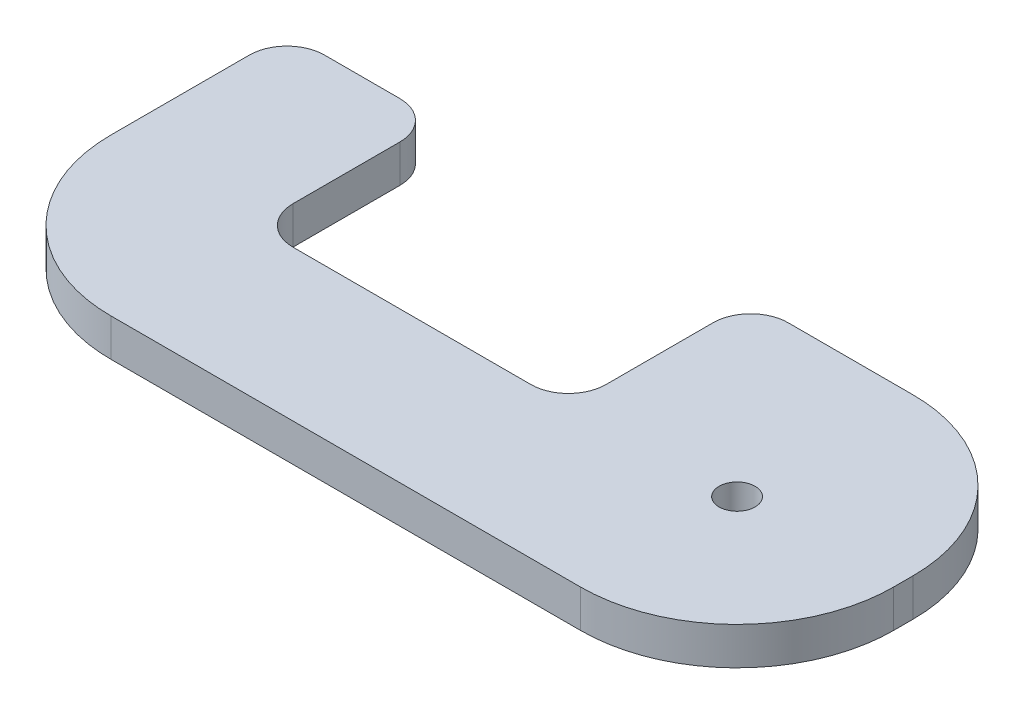
from build123d import *

# Parameters (mm, degrees)
SKETCH1_W           = 50.8
SKETCH1_H           = 21.59
BOSS_EXTRUDE1_DEPTH = 3.175
FILLET1_R           = 10.16
SKETCH3_R           = 1.16713
CUT_EXTRUDE1_DEPTH  = 28.780796425
FILLET3_R           = 10.16
SCALE1_SCALE_X      = 1.3
SCALE1_SCALE_Y      = 1
SCALE1_SCALE_Z      = 1.3
SKETCH4_W           = 26.416
SKETCH4_H           = 15.367
CUT_EXTRUDE2_DEPTH  = 37.195267212
FILLET4_R           = 3.175


with BuildPart() as part:
    # Sketch1 → Boss-Extrude1 (new body)
    with BuildSketch(Plane(origin=(0, 0, 0), x_dir=(1, 0, 0), z_dir=(0, 1, 0))):
        Rectangle(SKETCH1_W, SKETCH1_H)
    extrude(amount=BOSS_EXTRUDE1_DEPTH)

    # Fillet1
    fillet1_edges = [part.edges().sort_by_distance(p)[0] for p in [
        (25.4, 1.5875, 10.795),
        (-25.4, 1.5875, 10.795),
    ]]
    fillet(fillet1_edges, radius=FILLET1_R)

    # Sketch3 → Cut-Extrude1 (cut, through all)
    with BuildSketch(Plane(origin=(0, 3.175, 0), x_dir=(1, 0, 0), z_dir=(0, 1, 0))):
        with Locations(Location((15.24, -0.635, 0), (0, 0, 270))):
            Circle(SKETCH3_R)
    extrude(amount=-CUT_EXTRUDE1_DEPTH, mode=Mode.SUBTRACT)

    # Fillet3
    fillet3_edges = [part.edges().sort_by_distance(p)[0] for p in [
        (25.4, 1.5875, -10.795),
    ]]
    fillet(fillet3_edges, radius=FILLET3_R)


with BuildPart() as part_1:
    # Scale1: scaled about (-0.562959999, 1.5875, -0.186718305)
    add(part.part.scale((SCALE1_SCALE_X, SCALE1_SCALE_Y, SCALE1_SCALE_Z), about=(-0.562959999, 1.5875, -0.186718305)))

    # Sketch4 → Cut-Extrude2 (cut, through all)
    with BuildSketch(Plane(origin=(0, 3.175, 0), x_dir=(1, 0, 0), z_dir=(0, 1, 0))):
        with Locations((-6.943112, 6.293984509)):
            Rectangle(SKETCH4_W, SKETCH4_H)
    extrude(amount=-CUT_EXTRUDE2_DEPTH, mode=Mode.SUBTRACT)

    # Fillet4
    fillet4_edges = [part_1.edges().sort_by_distance(p)[0] for p in [
        (6.264888, 1.5875, -13.977484509),
        (6.264888, 1.5875, 1.389515491),
        (-20.151112, 1.5875, 1.389515491),
        (-20.151112, 1.5875, -13.977484509),
        (-32.851112, 1.5875, -13.977484508),
    ]]
    fillet(fillet4_edges, radius=FILLET4_R)


solid = part_1.part
